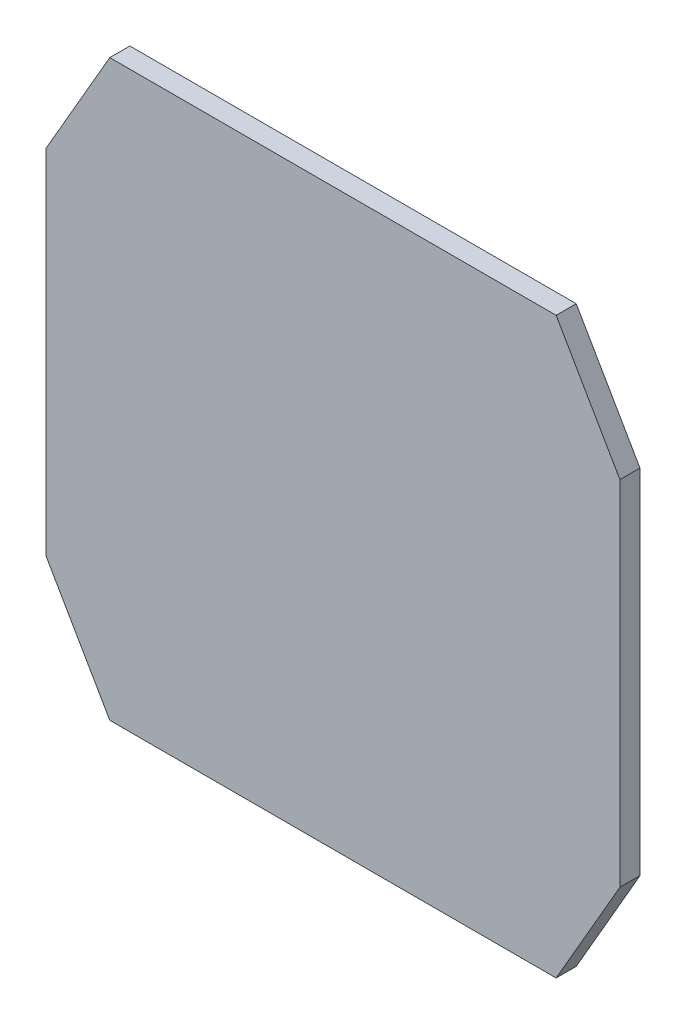
from build123d import *
from OCP.BRepFilletAPI import BRepFilletAPI_MakeChamfer

# Parameters (mm, degrees)
SCHIZZO1_W                   = 900
SCHIZZO1_H                   = 900
ESTRUSIONE_ESTRUSIONE1_DEPTH = 31.5
SMUSSO1_SIZE                 = 100
SMUSSO1_SIZE2                = 173.205080757
SMUSSO2_SIZE                 = 100
SMUSSO2_SIZE2                = 173.205080757


with BuildPart() as part:
    # Schizzo1 → Estrusione-Estrusione1 (new body)
    with BuildSketch(Plane.XY):
        Rectangle(SCHIZZO1_W, SCHIZZO1_H)
    extrude(amount=ESTRUSIONE_ESTRUSIONE1_DEPTH)

    # Smusso1: one chamfer whose edges measure the first distance from different faces: ONE call of the kernel's chamfer builder (chamfer() names one face for all edges)
    smusso1_edges_1 = [part.edges().sort_by_distance(p)[0] for p in [
        (450, -450, 15.75),
    ]]
    smusso1_side_1 = [part.faces().sort_by_distance(p)[0] for p in [
        (0, -450, 15.75),
    ]]
    smusso1_edges_2 = [part.edges().sort_by_distance(p)[0] for p in [
        (-450, 450, 15.75),
    ]]
    smusso1_side_2 = [part.faces().sort_by_distance(p)[0] for p in [
        (0, 450, 15.75),
    ]]
    smusso1 = BRepFilletAPI_MakeChamfer(part.part.solid().wrapped)
    for e in smusso1_edges_1:
        smusso1.Add(SMUSSO1_SIZE, SMUSSO1_SIZE2, e.wrapped, smusso1_side_1[0].wrapped)  # the first distance lies on this face
    for e in smusso1_edges_2:
        smusso1.Add(SMUSSO1_SIZE, SMUSSO1_SIZE2, e.wrapped, smusso1_side_2[0].wrapped)  # the first distance lies on this face
    add(Compound.cast(smusso1.Shape()), mode=Mode.REPLACE)

    # Smusso2: one chamfer whose edges measure the first distance from different faces: ONE call of the kernel's chamfer builder (chamfer() names one face for all edges)
    smusso2_edges_1 = [part.edges().sort_by_distance(p)[0] for p in [
        (-450, -450, 15.75),
    ]]
    smusso2_side_1 = [part.faces().sort_by_distance(p)[0] for p in [
        (-50, -450, 15.75),
    ]]
    smusso2_edges_2 = [part.edges().sort_by_distance(p)[0] for p in [
        (450, 450, 15.75),
    ]]
    smusso2_side_2 = [part.faces().sort_by_distance(p)[0] for p in [
        (50, 450, 15.75),
    ]]
    smusso2 = BRepFilletAPI_MakeChamfer(part.part.solid().wrapped)
    for e in smusso2_edges_1:
        smusso2.Add(SMUSSO2_SIZE, SMUSSO2_SIZE2, e.wrapped, smusso2_side_1[0].wrapped)  # the first distance lies on this face
    for e in smusso2_edges_2:
        smusso2.Add(SMUSSO2_SIZE, SMUSSO2_SIZE2, e.wrapped, smusso2_side_2[0].wrapped)  # the first distance lies on this face
    add(Compound.cast(smusso2.Shape()), mode=Mode.REPLACE)


solid = part.part
